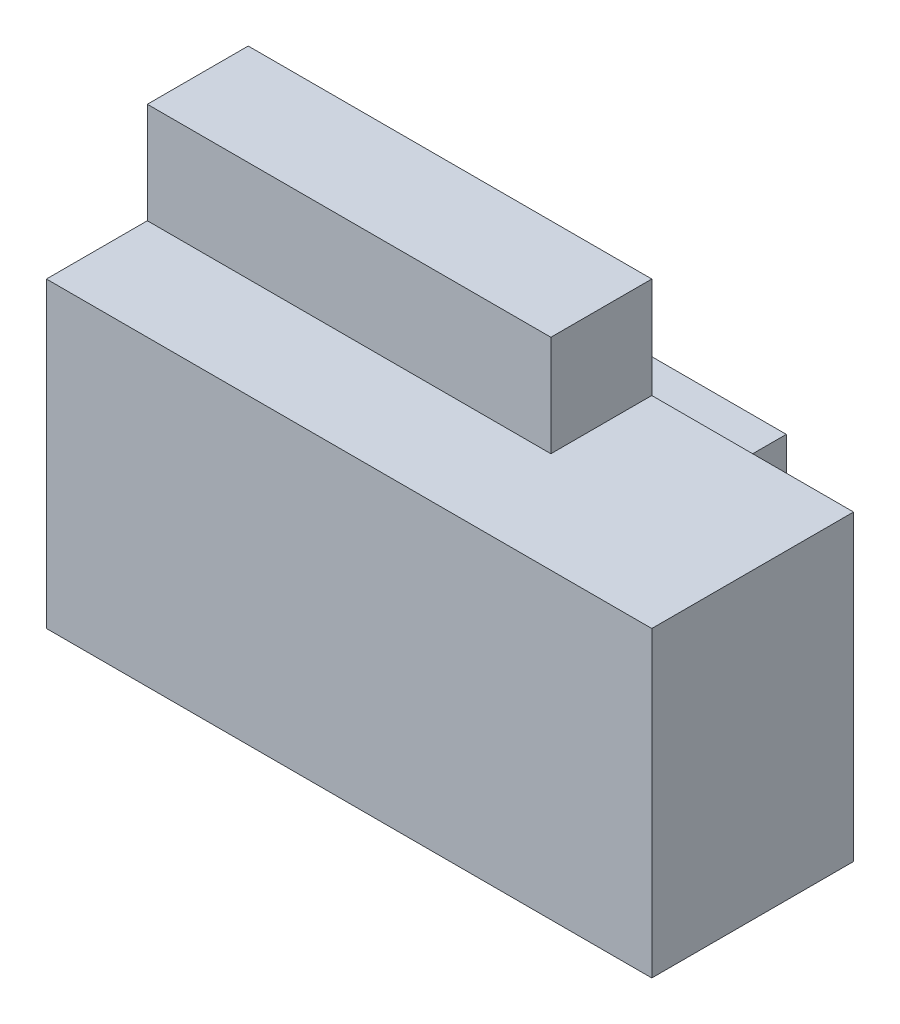
from build123d import *

# Parameters (mm, degrees)
BOSS_EXTRUDE1_DEPTH = 36
SKETCH1_3_W         = 48
SKETCH1_3_H         = 12
BOSS_EXTRUDE2_DEPTH = 48
SKETCH1_4_W         = 48
SKETCH1_4_H         = 16
BOSS_EXTRUDE3_DEPTH = 24


with BuildPart() as part:
    # Sketch1 → Boss-Extrude1 (new body)
    with BuildSketch(Plane(origin=(0, 0, 0), x_dir=(1, 0, 0), z_dir=(0, 1, 0))):
        Polygon((0, 12), (0, 0), (72, 0), (72, 24), (48, 24), (48, 12), align=None)
    extrude(amount=BOSS_EXTRUDE1_DEPTH)

    # Sketch1<3> → Boss-Extrude2 (add)
    with BuildSketch(Plane(origin=(0, 0, 0), x_dir=(1, 0, 0), z_dir=(0, 1, 0))):
        with Locations((24, 18)):
            Rectangle(SKETCH1_3_W, SKETCH1_3_H)
    extrude(amount=BOSS_EXTRUDE2_DEPTH)

    # Sketch1<4> → Boss-Extrude3 (add)
    with BuildSketch(Plane(origin=(0, 0, 0), x_dir=(1, 0, 0), z_dir=(0, 1, 0))):
        with Locations((24, 32)):
            Rectangle(SKETCH1_4_W, SKETCH1_4_H)
    extrude(amount=BOSS_EXTRUDE3_DEPTH)


solid = part.part
